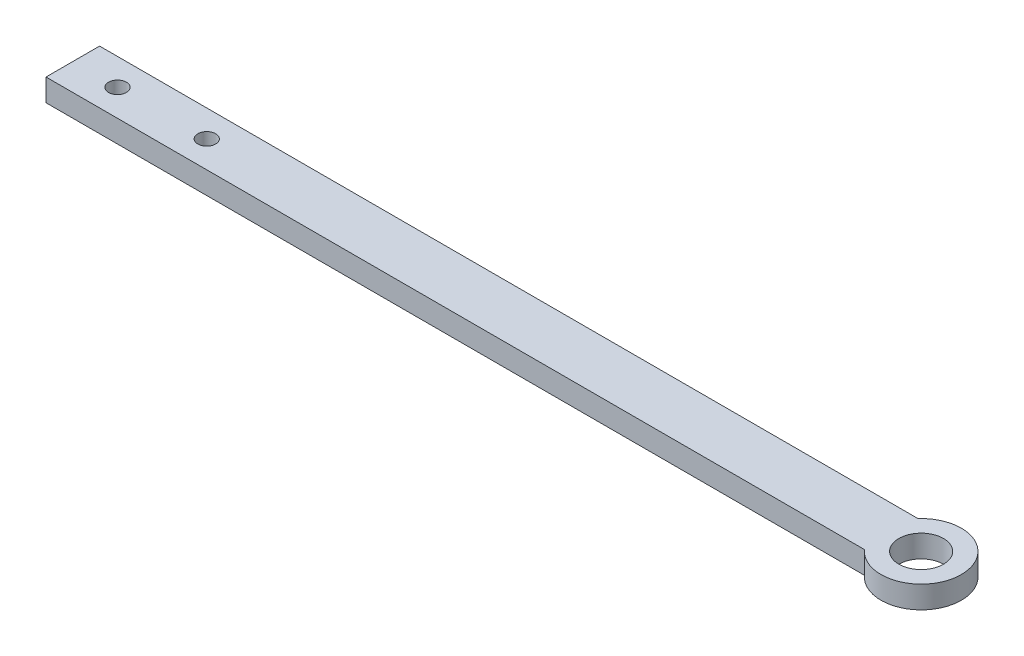
from build123d import *

# Parameters (mm, degrees)
BOSS_EXTRUDE1_DEPTH = 5
SKETCH2_R           = 5
SKETCH2_R_2         = 2
CUT_EXTRUDE1_DEPTH  = 191.278742901


with BuildPart() as part:
    # Sketch1 → Boss-Extrude1 (new body)
    with BuildSketch(Plane(origin=(0, 0, 0), x_dir=(1, 0, 0), z_dir=(0, 1, 0))):
        with BuildLine():
            Line((-6.708203932, 6), (-190, 6))
            Line((-190, 6), (-190, -6))
            Line((-190, -6), (-6.708203932, -6))
            ThreePointArc((-6.708203932, -6), (9, 0), (-6.708203932, 6))
        make_face()
    extrude(amount=BOSS_EXTRUDE1_DEPTH)

    # Sketch2 → Cut-Extrude1 (cut, through all)
    with BuildSketch(Plane(origin=(0, 5, 0), x_dir=(1, 0, 0), z_dir=(0, 1, 0))):
        with Locations(Location((0, 0, 0), (0, 0, 270))):
            Circle(SKETCH2_R)
        with Locations(Location((-180, 0, 0), (0, 0, 270))):
            Circle(SKETCH2_R_2)
        with Locations(Location((-160, 0, 0), (0, 0, 270))):
            Circle(SKETCH2_R_2)
    extrude(amount=-CUT_EXTRUDE1_DEPTH, mode=Mode.SUBTRACT)


solid = part.part
